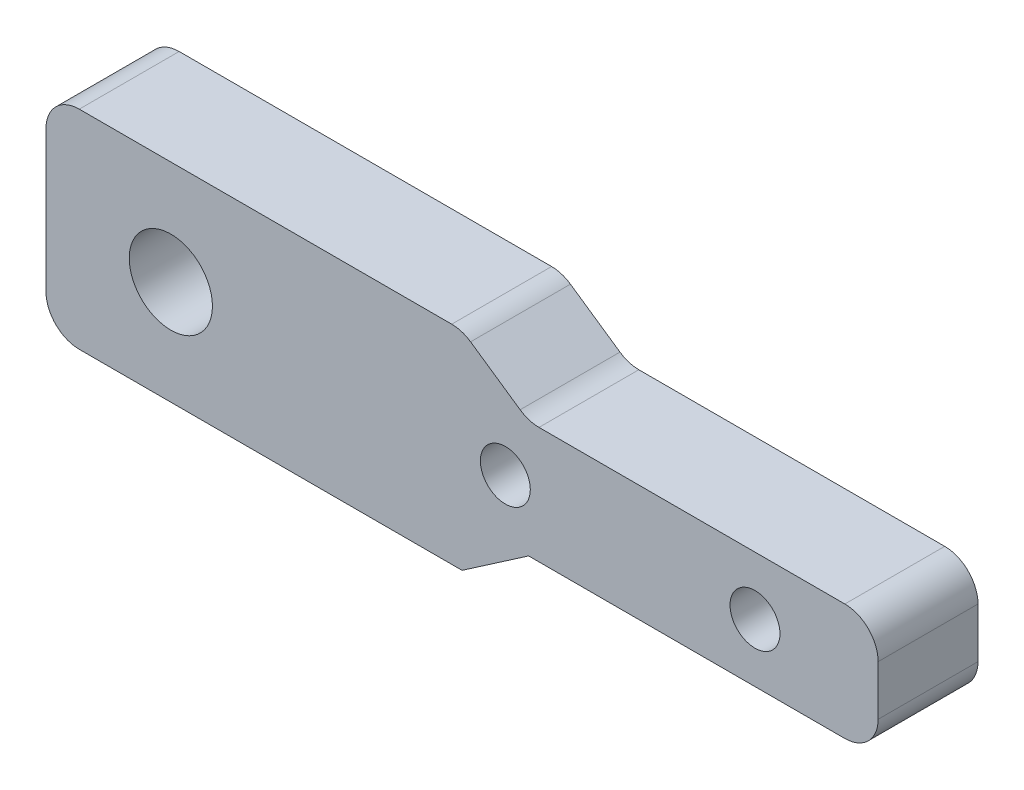
from build123d import *

# Parameters (mm, degrees)
BOSS_EXTRU_1_DEPTH      = 6
ESQUISSE2_R             = 2.5
ESQUISSE2_R_2           = 1.5
ENL_V_MAT_EXTRU_1_DEPTH = 29.298078094
CONG_2_R                = 2


with BuildPart() as part:
    # Esquisse1 → Boss.-Extru.1 (new body)
    with BuildSketch(Plane.XY):
        Polygon((5.939167095, 3.5), (26.939167095, 3.5), (26.939167095, -3.5), (5.939167095, -3.5), (1.939167095, -6.25), (-23.060832905, -6.25), (-23.060832905, 6.25), (1.939167095, 6.25), align=None)
    extrude(amount=BOSS_EXTRU_1_DEPTH)

    # Esquisse2 → Enlèv. mat.-Extru.1 (cut, through all)
    with BuildSketch(Plane.XY.offset(6)):
        with Locations((-15.560832905, 0)):
            Circle(ESQUISSE2_R)
        with Locations((4.539167095, 0)):
            Circle(ESQUISSE2_R_2)
        with Locations((19.539167095, 0)):
            Circle(ESQUISSE2_R_2)
    extrude(amount=-ENL_V_MAT_EXTRU_1_DEPTH, mode=Mode.SUBTRACT)

    # Congé2
    cong_2_edges = [part.edges().sort_by_distance(p)[0] for p in [
        (-23.060832905, 6.25, 3),
        (1.939167095, 6.25, 3),
        (5.939167095, 3.5, 3),
        (26.939167095, 3.5, 3),
        (26.939167095, -3.5, 3),
        (-23.060832905, -6.25, 3),
    ]]
    fillet(cong_2_edges, radius=CONG_2_R)


solid = part.part
